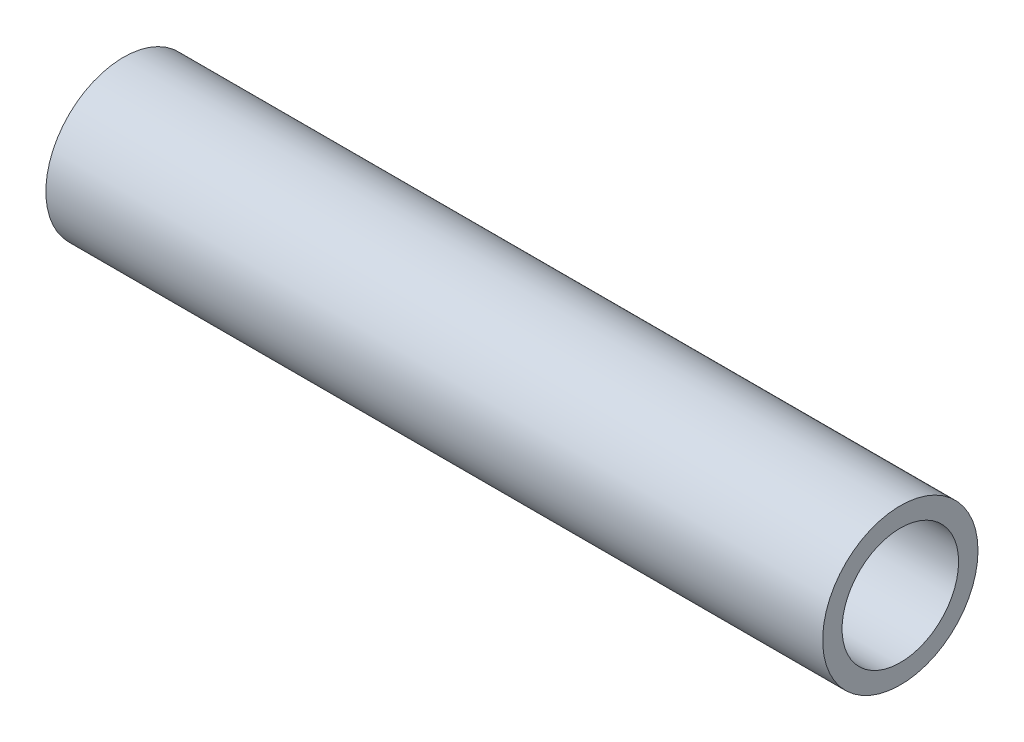
from build123d import *

# Parameters (mm, degrees)
SKETCH_1_R      = 2
SKETCH_1_R_2    = 1.5
EXTRUDE_1_DEPTH = 20


with BuildPart() as part:
    # 草图1 → 凸台-拉伸1 (new body)
    with BuildSketch(Plane(origin=(0, 0, 0), x_dir=(0, 0, -1), z_dir=(1, 0, 0))):
        Circle(SKETCH_1_R)
        Circle(SKETCH_1_R_2, mode=Mode.SUBTRACT)
    extrude(amount=EXTRUDE_1_DEPTH)


solid = part.part
